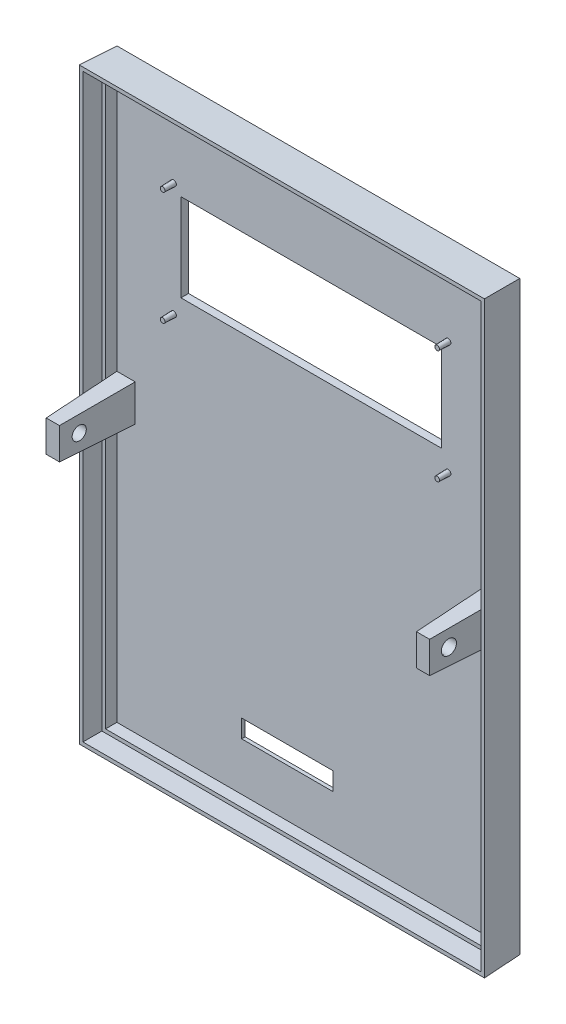
from build123d import *

# Parameters (mm, degrees)
SKETCH1_W                     = 110
SKETCH1_H                     = 160
BOSS_EXTRUDE1_DEPTH           = 10
BOSS_EXTRUDE1_DRAFT           = -2
SHELL1_T                      = -2
SKETCH3_W                     = 108.69841539
SKETCH3_H                     = 158.69841539
CUT_EXTRUDE3_DEPTH            = 5
CUT_EXTRUDE3_DRAFT            = -2
SKETCH4_W                     = 71
SKETCH4_H                     = 23.8
CUT_EXTRUDE4_DEPTH            = 2
CUT_EXTRUDE4_DRAFT            = 2
SKETCH10_R                    = 0.75
BOSS_EXTRUDE3_DEPTH           = 3
BOSS_EXTRUDE3_DRAFT           = 2
BOSS_EXTRUDE3_PROFILE_2_DEPTH = 3
BOSS_EXTRUDE3_PROFILE_2_DRAFT = 2
BOSS_EXTRUDE3_PROFILE_3_DEPTH = 3
BOSS_EXTRUDE3_PROFILE_3_DRAFT = 2
BOSS_EXTRUDE3_PROFILE_4_DEPTH = 3
BOSS_EXTRUDE3_PROFILE_4_DRAFT = 2
SKETCH13_W                    = 5
SKETCH13_H                    = 10
BOSS_EXTRUDE8_DEPTH           = 20
BOSS_EXTRUDE8_DRAFT           = 2
BOSS_EXTRUDE8_PROFILE_2_DEPTH = 20
BOSS_EXTRUDE8_PROFILE_2_DRAFT = 2
CUT_EXTRUDE8_REACH            = 138.446
SKETCH21_R                    = 2
CUT_EXTRUDE8_DRAFT            = -2
CUT_EXTRUDE9_REACH            = 138.446
SKETCH22_R                    = 2
CUT_EXTRUDE9_DRAFT            = -2
SKETCH27_W                    = 69
SKETCH27_H                    = 76
CUT_EXTRUDE10_DEPTH           = 1
CUT_EXTRUDE10_DRAFT           = -2
SKETCH28_W                    = 25
SKETCH28_H                    = 5
CUT_EXTRUDE11_DEPTH           = 1
CUT_EXTRUDE11_DRAFT           = -2


with BuildPart() as part:
    # Sketch1 → Boss-Extrude1 (with draft: the straight prism first)
    with BuildSketch(Plane.XY):
        Rectangle(SKETCH1_W, SKETCH1_H)
    extrude(amount=BOSS_EXTRUDE1_DEPTH)
    # Boss-Extrude1: the draft: its side faces are tilted about the plane it starts from
    boss_extrude1_sides = [part.faces().sort_by_distance(p)[0] for p in [
        (55, 0, 5),
        (0, 80, 5),
        (-55, 0, 5),
        (0, -80, 5),
    ]]
    draft(boss_extrude1_sides, Plane.XY, BOSS_EXTRUDE1_DRAFT)

    # Shell1
    shell1_openings = [part.faces().sort_by_distance(p)[0] for p in [
        (0, 0, 10),
    ]]
    offset(amount=SHELL1_T, openings=shell1_openings, kind=Kind.INTERSECTION)


with BuildPart() as cut_extrude3_tool:
    # Sketch3 → Cut-Extrude3 (with draft: the straight prism first)
    with BuildSketch(Plane.XY.offset(10)):
        Rectangle(SKETCH3_W, SKETCH3_H)
    extrude(amount=-CUT_EXTRUDE3_DEPTH)
    # Cut-Extrude3: the draft: its side faces are tilted about the plane it starts from
    cut_extrude3_sides = [cut_extrude3_tool.faces().sort_by_distance(p)[0] for p in [
        (54.349207695, 0, 7.5),
        (0, 79.349207695, 7.5),
        (-54.349207695, 0, 7.5),
        (0, -79.349207695, 7.5),
    ]]
    draft(cut_extrude3_sides, Plane.XY.offset(10), CUT_EXTRUDE3_DRAFT)


with BuildPart() as part_1:
    add(part.part)

    # Cut-Extrude3: cut by cut_extrude3_tool
    add(cut_extrude3_tool.part, mode=Mode.SUBTRACT)


with BuildPart() as cut_extrude4_tool:
    # Sketch4 → Cut-Extrude4 (with draft: the straight prism first)
    with BuildSketch(Plane(origin=(0, 0, 0), x_dir=(-1, 0, 0), z_dir=(0, 0, -1))):
        with Locations((0, 43.1)):
            Rectangle(SKETCH4_W, SKETCH4_H)
    extrude(amount=-CUT_EXTRUDE4_DEPTH)
    # Cut-Extrude4: the draft: its side faces are tilted about the plane it starts from
    cut_extrude4_sides = [cut_extrude4_tool.faces().sort_by_distance(p)[0] for p in [
        (-35.5, 43.1, 1),
        (0, 55, 1),
        (35.5, 43.1, 1),
        (0, 31.2, 1),
    ]]
    draft(cut_extrude4_sides, Plane(origin=(0, 0, 0), x_dir=(-1, 0, 0), z_dir=(0, 0, -1)), CUT_EXTRUDE4_DRAFT)


with BuildPart() as part_2:
    add(part_1.part)

    # Cut-Extrude4: cut by cut_extrude4_tool
    add(cut_extrude4_tool.part, mode=Mode.SUBTRACT)


with BuildPart() as boss_extrude3_tool:
    # Sketch10 → Boss-Extrude3 (with draft: the straight prism first)
    with BuildSketch(Plane.XY.offset(2)):
        with Locations((-37.569841539, 57.294841539)):
            Circle(SKETCH10_R)
    extrude(amount=BOSS_EXTRUDE3_DEPTH)
    # Boss-Extrude3: the draft: its side faces are tilted about the plane it starts from
    boss_extrude3_sides = [boss_extrude3_tool.faces().sort_by_distance(p)[0] for p in [
        (-38.319841539, 57.294841539, 3.5),
    ]]
    draft(boss_extrude3_sides, Plane.XY.offset(2), BOSS_EXTRUDE3_DRAFT)


with BuildPart() as part_3:
    add(part_2.part)

    # Boss-Extrude3: add boss_extrude3_tool
    add(boss_extrude3_tool.part)


with BuildPart() as boss_extrude3_profile_2_tool:
    # Sketch10 → Boss-Extrude3 profile 2 (with draft: the straight prism first)
    with BuildSketch(Plane.XY.offset(2)):
        with Locations((37.430158461, 57.294841539)):
            Circle(SKETCH10_R)
    extrude(amount=BOSS_EXTRUDE3_PROFILE_2_DEPTH)
    # Boss-Extrude3 profile 2: the draft: its side faces are tilted about the plane it starts from
    boss_extrude3_profile_2_sides = [boss_extrude3_profile_2_tool.faces().sort_by_distance(p)[0] for p in [
        (36.680158461, 57.294841539, 3.5),
    ]]
    draft(boss_extrude3_profile_2_sides, Plane.XY.offset(2), BOSS_EXTRUDE3_PROFILE_2_DRAFT)


with BuildPart() as part_4:
    add(part_3.part)

    # Boss-Extrude3 profile 2: add boss_extrude3_profile_2_tool
    add(boss_extrude3_profile_2_tool.part)


with BuildPart() as boss_extrude3_profile_3_tool:
    # Sketch10 → Boss-Extrude3 profile 3 (with draft: the straight prism first)
    with BuildSketch(Plane.XY.offset(2)):
        with Locations((37.430158461, 26.294841539)):
            Circle(SKETCH10_R)
    extrude(amount=BOSS_EXTRUDE3_PROFILE_3_DEPTH)
    # Boss-Extrude3 profile 3: the draft: its side faces are tilted about the plane it starts from
    boss_extrude3_profile_3_sides = [boss_extrude3_profile_3_tool.faces().sort_by_distance(p)[0] for p in [
        (36.680158461, 26.294841539, 3.5),
    ]]
    draft(boss_extrude3_profile_3_sides, Plane.XY.offset(2), BOSS_EXTRUDE3_PROFILE_3_DRAFT)


with BuildPart() as part_5:
    add(part_4.part)

    # Boss-Extrude3 profile 3: add boss_extrude3_profile_3_tool
    add(boss_extrude3_profile_3_tool.part)


with BuildPart() as boss_extrude3_profile_4_tool:
    # Sketch10 → Boss-Extrude3 profile 4 (with draft: the straight prism first)
    with BuildSketch(Plane.XY.offset(2)):
        with Locations((-37.569841539, 26.294841539)):
            Circle(SKETCH10_R)
    extrude(amount=BOSS_EXTRUDE3_PROFILE_4_DEPTH)
    # Boss-Extrude3 profile 4: the draft: its side faces are tilted about the plane it starts from
    boss_extrude3_profile_4_sides = [boss_extrude3_profile_4_tool.faces().sort_by_distance(p)[0] for p in [
        (-38.319841539, 26.294841539, 3.5),
    ]]
    draft(boss_extrude3_profile_4_sides, Plane.XY.offset(2), BOSS_EXTRUDE3_PROFILE_4_DRAFT)


with BuildPart() as part_6:
    add(part_5.part)

    # Boss-Extrude3 profile 4: add boss_extrude3_profile_4_tool
    add(boss_extrude3_profile_4_tool.part)


with BuildPart() as boss_extrude8_tool:
    # Sketch13 → Boss-Extrude8 (with draft: the straight prism first)
    with BuildSketch(Plane.XY.offset(2)):
        with Locations((-50.56862245, 0)):
            Rectangle(SKETCH13_W, SKETCH13_H)
    extrude(amount=BOSS_EXTRUDE8_DEPTH)
    # Boss-Extrude8: the draft: its side faces are tilted about the plane it starts from
    boss_extrude8_sides = [boss_extrude8_tool.faces().sort_by_distance(p)[0] for p in [
        (-50.56862245, 5, 12),
        (-53.06862245, 0, 12),
        (-50.56862245, -5, 12),
        (-48.06862245, 0, 12),
    ]]
    draft(boss_extrude8_sides, Plane.XY.offset(2), BOSS_EXTRUDE8_DRAFT)


with BuildPart() as part_7:
    add(part_6.part)

    # Boss-Extrude8: add boss_extrude8_tool
    add(boss_extrude8_tool.part)


with BuildPart() as boss_extrude8_profile_2_tool:
    # Sketch13 → Boss-Extrude8 profile 2 (with draft: the straight prism first)
    with BuildSketch(Plane.XY.offset(2)):
        with Locations((50.56862245, 0)):
            Rectangle(SKETCH13_W, SKETCH13_H)
    extrude(amount=BOSS_EXTRUDE8_PROFILE_2_DEPTH)
    # Boss-Extrude8 profile 2: the draft: its side faces are tilted about the plane it starts from
    boss_extrude8_profile_2_sides = [boss_extrude8_profile_2_tool.faces().sort_by_distance(p)[0] for p in [
        (50.56862245, -5, 12),
        (53.06862245, 0, 12),
        (50.56862245, 5, 12),
        (48.06862245, 0, 12),
    ]]
    draft(boss_extrude8_profile_2_sides, Plane.XY.offset(2), BOSS_EXTRUDE8_PROFILE_2_DRAFT)


with BuildPart() as part_8:
    add(part_7.part)

    # Boss-Extrude8 profile 2: add boss_extrude8_profile_2_tool
    add(boss_extrude8_profile_2_tool.part)

    # Cut-Extrude8: up to this plane
    cut_extrude8_end = Plane(origin=(-48.06862245, 5, 2), z_dir=(0.9993908270190958, 0, 0.034899496702501004))



with BuildPart() as cut_extrude8_long_prism_1:
    # Sketch21 → Cut-Extrude8 (the long prism of profile 1, to be tilted and cut off)
    with BuildSketch(Plane(origin=(-53.073742676, 0, 1.853375934), x_dir=(0.03489949670250101, 0, 0.9993908270190958), z_dir=(-0.9993908270190958, 0, 0.03489949670250101))):
        with Locations((15.062248779, 0)):
            Circle(SKETCH21_R)
    extrude(amount=-CUT_EXTRUDE8_REACH)
    cut_extrude8_tool1_sides = [cut_extrude8_long_prism_1.faces().sort_by_distance(p)[0] for p in [
        (16.562954451, 0, 12.491819684),
    ]]
    draft(cut_extrude8_tool1_sides, Plane(origin=(-53.073742676, 0, 1.853375934), x_dir=(0.03489949670250101, 0, 0.9993908270190958), z_dir=(-0.9993908270190958, 0, 0.03489949670250101)), CUT_EXTRUDE8_DRAFT)  # the draft: side faces tilted about the start plane


with BuildPart() as part_9:
    add(part_8.part)
    cut_extrude8_tool1 = split(cut_extrude8_long_prism_1.part, bisect_by=cut_extrude8_end, keep=Keep.BOTH, mode=Mode.PRIVATE)
    add(cut_extrude8_tool1.solids().sort_by_distance((-52.548078, 0, 16.906449))[0], mode=Mode.SUBTRACT)

    # Cut-Extrude9: up to this plane
    cut_extrude9_end = Plane(origin=(48.06862245, -5, 2), z_dir=(-0.9993908270190958, 0, 0.034899496702501004))



with BuildPart() as cut_extrude9_long_prism_1:
    # Sketch22 → Cut-Extrude9 (the long prism of profile 1, to be tilted and cut off)
    with BuildSketch(Plane(origin=(53.073742676, 0, 1.853375934), x_dir=(0.03489949670250101, 0, -0.9993908270190958), z_dir=(0.9993908270190958, 0, 0.03489949670250101))):
        with Locations((-15.062248779, 0)):
            Circle(SKETCH22_R)
    extrude(amount=-CUT_EXTRUDE9_REACH)
    cut_extrude9_tool1_sides = [cut_extrude9_long_prism_1.faces().sort_by_distance(p)[0] for p in [
        (-16.702552438, 0, 16.489382992),
    ]]
    draft(cut_extrude9_tool1_sides, Plane(origin=(53.073742676, 0, 1.853375934), x_dir=(0.03489949670250101, 0, -0.9993908270190958), z_dir=(0.9993908270190958, 0, 0.03489949670250101)), CUT_EXTRUDE9_DRAFT)  # the draft: side faces tilted about the start plane


with BuildPart() as part_10:
    add(part_9.part)
    cut_extrude9_tool1 = split(cut_extrude9_long_prism_1.part, bisect_by=cut_extrude9_end, keep=Keep.BOTH, mode=Mode.PRIVATE)
    add(cut_extrude9_tool1.solids().sort_by_distance((52.548078, 0, 16.906449))[0], mode=Mode.SUBTRACT)


with BuildPart() as cut_extrude10_tool:
    # Sketch27 → Cut-Extrude10 (with draft: the straight prism first)
    with BuildSketch(Plane(origin=(0, 0, 0), x_dir=(-1, 0, 0), z_dir=(0, 0, -1))):
        with Locations((5.5, -31.8)):
            Rectangle(SKETCH27_W, SKETCH27_H)
    extrude(amount=-CUT_EXTRUDE10_DEPTH)
    # Cut-Extrude10: the draft: its side faces are tilted about the plane it starts from
    cut_extrude10_sides = [cut_extrude10_tool.faces().sort_by_distance(p)[0] for p in [
        (-40, -31.8, 0.5),
        (-5.5, 6.2, 0.5),
        (29, -31.8, 0.5),
        (-5.5, -69.8, 0.5),
    ]]
    draft(cut_extrude10_sides, Plane(origin=(0, 0, 0), x_dir=(-1, 0, 0), z_dir=(0, 0, -1)), CUT_EXTRUDE10_DRAFT)


with BuildPart() as part_11:
    add(part_10.part)

    # Cut-Extrude10: cut by cut_extrude10_tool
    add(cut_extrude10_tool.part, mode=Mode.SUBTRACT)


with BuildPart() as cut_extrude11_tool:
    # Sketch28 → Cut-Extrude11 (with draft: the straight prism first)
    with BuildSketch(Plane(origin=(0, 0, 1), x_dir=(-1, 0, 0), z_dir=(0, 0, -1))):
        with Locations((6.534920769, -62.465079231)):
            Rectangle(SKETCH28_W, SKETCH28_H)
    extrude(amount=-CUT_EXTRUDE11_DEPTH)
    # Cut-Extrude11: the draft: its side faces are tilted about the plane it starts from
    cut_extrude11_sides = [cut_extrude11_tool.faces().sort_by_distance(p)[0] for p in [
        (-6.534920769, -59.965079231, 1.5),
        (5.965079231, -62.465079231, 1.5),
        (-6.534920769, -64.965079231, 1.5),
        (-19.034920769, -62.465079231, 1.5),
    ]]
    draft(cut_extrude11_sides, Plane(origin=(0, 0, 1), x_dir=(-1, 0, 0), z_dir=(0, 0, -1)), CUT_EXTRUDE11_DRAFT)


with BuildPart() as part_12:
    add(part_11.part)

    # Cut-Extrude11: cut by cut_extrude11_tool
    add(cut_extrude11_tool.part, mode=Mode.SUBTRACT)


solid = part_12.part
